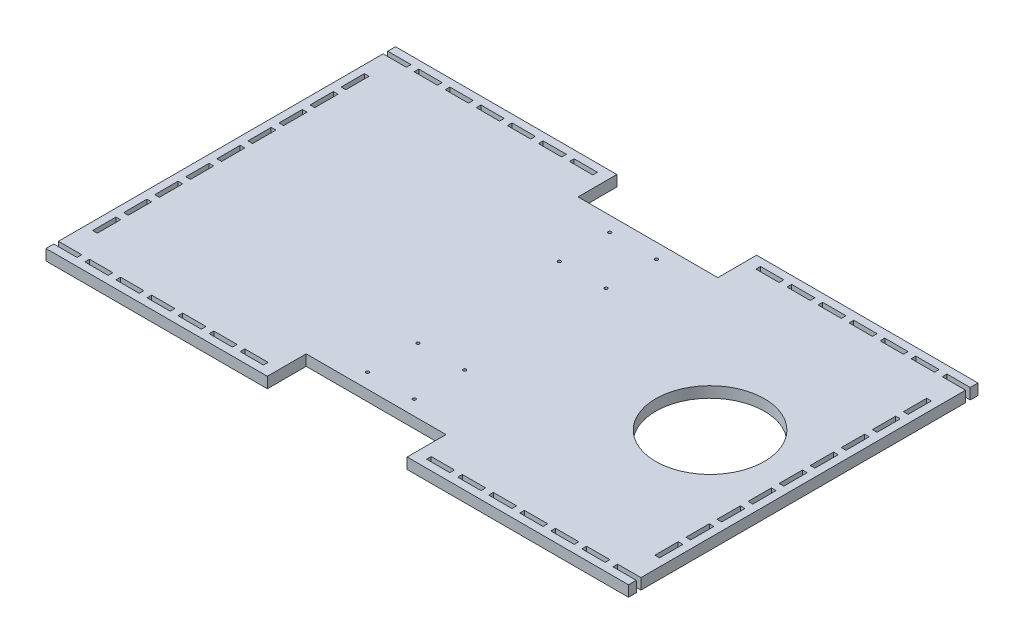
from build123d import *

# Parameters (mm, degrees)
SKETCH6_W           = 15
SKETCH6_H           = 3
SKETCH6_W_2         = 3
SKETCH6_H_2         = 15
SKETCH6_R           = 1
SKETCH6_R_2         = 35
BOSS_EXTRUDE3_DEPTH = 7


with BuildPart() as part:
    # Sketch6 → Boss-Extrude3 (new body)
    with BuildSketch(Plane(origin=(0, 0, 0), x_dir=(1, 0, 0), z_dir=(0, 1, 0))):
        Polygon((-45, 112.5), (-187.5, 112.5), (-187.5, 107.5), (-172.5, 107.5), (-172.5, 104.5), (-187.5, 104.5), (-187.5, -104.5), (-172.5, -104.5), (-172.5, -107.5), (-187.5, -107.5), (-187.5, -112.5), (-45, -112.5), (-45, -87.5), (45, -87.5), (45, -112.5), (187.5, -112.5), (187.5, -107.5), (172.5, -107.5), (172.5, -104.5), (187.5, -104.5), (187.5, 104.5), (172.5, 104.5), (172.5, 107.5), (187.5, 107.5), (187.5, 112.5), (45, 112.5), (45, 87.5), (-45, 87.5), align=None)
        with Locations((-160, -106)):
            Rectangle(SKETCH6_W, SKETCH6_H, mode=Mode.SUBTRACT)
        with Locations((-140, -106)):
            Rectangle(SKETCH6_W, SKETCH6_H, mode=Mode.SUBTRACT)
        with Locations((-120, -106)):
            Rectangle(SKETCH6_W, SKETCH6_H, mode=Mode.SUBTRACT)
        with Locations((-100, -106)):
            Rectangle(SKETCH6_W, SKETCH6_H, mode=Mode.SUBTRACT)
        with Locations((-181, -80)):
            Rectangle(SKETCH6_W_2, SKETCH6_H_2, mode=Mode.SUBTRACT)
        with Locations((-181, -60)):
            Rectangle(SKETCH6_W_2, SKETCH6_H_2, mode=Mode.SUBTRACT)
        with Locations((-80, -106)):
            Rectangle(SKETCH6_W, SKETCH6_H, mode=Mode.SUBTRACT)
        with Locations((-60, -106)):
            Rectangle(SKETCH6_W, SKETCH6_H, mode=Mode.SUBTRACT)
        with Locations(Location((-15, -77.920021532, 0), (0, 0, 270))):
            Circle(SKETCH6_R, mode=Mode.SUBTRACT)
        with Locations((-181, -40)):
            Rectangle(SKETCH6_W_2, SKETCH6_H_2, mode=Mode.SUBTRACT)
        with Locations((-181, -20)):
            Rectangle(SKETCH6_W_2, SKETCH6_H_2, mode=Mode.SUBTRACT)
        with Locations(Location((-15, -45.520021532, 0), (0, 0, 270))):
            Circle(SKETCH6_R, mode=Mode.SUBTRACT)
        with Locations((60, -106)):
            Rectangle(SKETCH6_W, SKETCH6_H, mode=Mode.SUBTRACT)
        with Locations((80, -106)):
            Rectangle(SKETCH6_W, SKETCH6_H, mode=Mode.SUBTRACT)
        with Locations(Location((15, -77.920021532, 0), (0, 0, 270))):
            Circle(SKETCH6_R, mode=Mode.SUBTRACT)
        with Locations((100, -106)):
            Rectangle(SKETCH6_W, SKETCH6_H, mode=Mode.SUBTRACT)
        with Locations((120, -106)):
            Rectangle(SKETCH6_W, SKETCH6_H, mode=Mode.SUBTRACT)
        with Locations((140, -106)):
            Rectangle(SKETCH6_W, SKETCH6_H, mode=Mode.SUBTRACT)
        with Locations((160, -106)):
            Rectangle(SKETCH6_W, SKETCH6_H, mode=Mode.SUBTRACT)
        with Locations((181, -80)):
            Rectangle(SKETCH6_W_2, SKETCH6_H_2, mode=Mode.SUBTRACT)
        with Locations((181, -60)):
            Rectangle(SKETCH6_W_2, SKETCH6_H_2, mode=Mode.SUBTRACT)
        with Locations(Location((15, -45.520021532, 0), (0, 0, 270))):
            Circle(SKETCH6_R, mode=Mode.SUBTRACT)
        with Locations((181, -40)):
            Rectangle(SKETCH6_W_2, SKETCH6_H_2, mode=Mode.SUBTRACT)
        with Locations((181, -20)):
            Rectangle(SKETCH6_W_2, SKETCH6_H_2, mode=Mode.SUBTRACT)
        with Locations((-181, 0)):
            Rectangle(SKETCH6_W_2, SKETCH6_H_2, mode=Mode.SUBTRACT)
        with Locations((-181, 20)):
            Rectangle(SKETCH6_W_2, SKETCH6_H_2, mode=Mode.SUBTRACT)
        with Locations((-181, 40)):
            Rectangle(SKETCH6_W_2, SKETCH6_H_2, mode=Mode.SUBTRACT)
        with Locations(Location((-15, 45.520021532, 0), (0, 0, 270))):
            Circle(SKETCH6_R, mode=Mode.SUBTRACT)
        with Locations((-181, 60)):
            Rectangle(SKETCH6_W_2, SKETCH6_H_2, mode=Mode.SUBTRACT)
        with Locations((-181, 80)):
            Rectangle(SKETCH6_W_2, SKETCH6_H_2, mode=Mode.SUBTRACT)
        with Locations((-160, 106)):
            Rectangle(SKETCH6_W, SKETCH6_H, mode=Mode.SUBTRACT)
        with Locations((-140, 106)):
            Rectangle(SKETCH6_W, SKETCH6_H, mode=Mode.SUBTRACT)
        with Locations((-120, 106)):
            Rectangle(SKETCH6_W, SKETCH6_H, mode=Mode.SUBTRACT)
        with Locations((-100, 106)):
            Rectangle(SKETCH6_W, SKETCH6_H, mode=Mode.SUBTRACT)
        with Locations(Location((-15, 77.920021532, 0), (0, 0, 270))):
            Circle(SKETCH6_R, mode=Mode.SUBTRACT)
        with Locations((-80, 106)):
            Rectangle(SKETCH6_W, SKETCH6_H, mode=Mode.SUBTRACT)
        with Locations((-60, 106)):
            Rectangle(SKETCH6_W, SKETCH6_H, mode=Mode.SUBTRACT)
        with Locations(Location((15, 45.520021532, 0), (0, 0, 270))):
            Circle(SKETCH6_R, mode=Mode.SUBTRACT)
        with Locations(Location((127.5, 0, 0), (0, 0, 270))):
            Circle(SKETCH6_R_2, mode=Mode.SUBTRACT)
        with Locations((181, 0)):
            Rectangle(SKETCH6_W_2, SKETCH6_H_2, mode=Mode.SUBTRACT)
        with Locations((181, 20)):
            Rectangle(SKETCH6_W_2, SKETCH6_H_2, mode=Mode.SUBTRACT)
        with Locations((181, 40)):
            Rectangle(SKETCH6_W_2, SKETCH6_H_2, mode=Mode.SUBTRACT)
        with Locations(Location((15, 77.920021532, 0), (0, 0, 270))):
            Circle(SKETCH6_R, mode=Mode.SUBTRACT)
        with Locations((60, 106)):
            Rectangle(SKETCH6_W, SKETCH6_H, mode=Mode.SUBTRACT)
        with Locations((80, 106)):
            Rectangle(SKETCH6_W, SKETCH6_H, mode=Mode.SUBTRACT)
        with Locations((181, 60)):
            Rectangle(SKETCH6_W_2, SKETCH6_H_2, mode=Mode.SUBTRACT)
        with Locations((181, 80)):
            Rectangle(SKETCH6_W_2, SKETCH6_H_2, mode=Mode.SUBTRACT)
        with Locations((100, 106)):
            Rectangle(SKETCH6_W, SKETCH6_H, mode=Mode.SUBTRACT)
        with Locations((120, 106)):
            Rectangle(SKETCH6_W, SKETCH6_H, mode=Mode.SUBTRACT)
        with Locations((140, 106)):
            Rectangle(SKETCH6_W, SKETCH6_H, mode=Mode.SUBTRACT)
        with Locations((160, 106)):
            Rectangle(SKETCH6_W, SKETCH6_H, mode=Mode.SUBTRACT)
    extrude(amount=BOSS_EXTRUDE3_DEPTH)


solid = part.part
